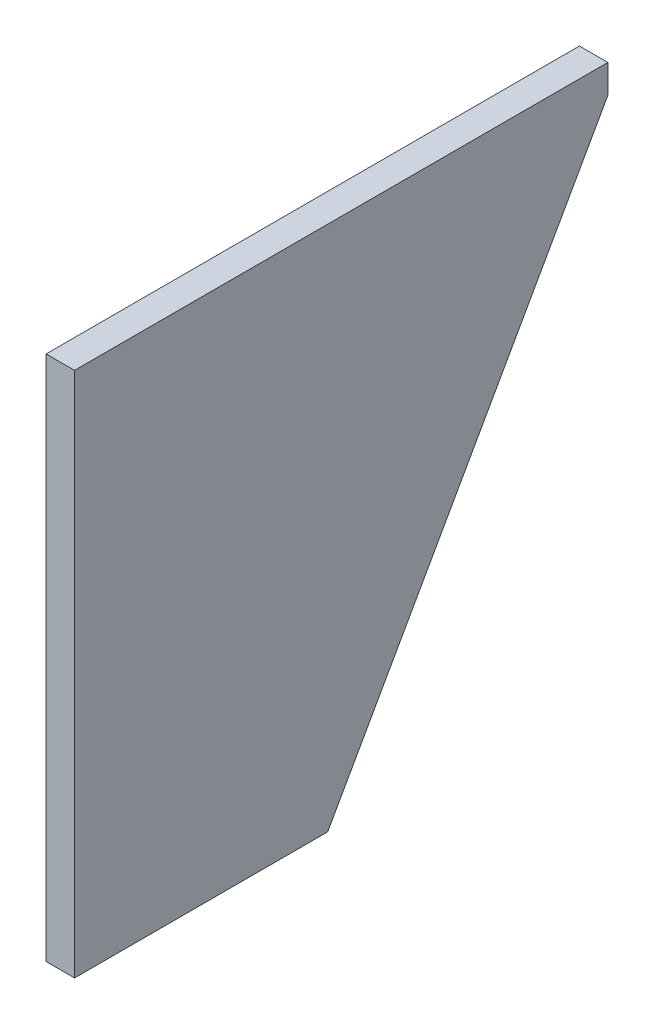
from build123d import *

# Parameters (mm, degrees)
SALIENTE_EXTRUIR1_DEPTH = 20


with BuildPart() as part:
    # Croquis2 → Saliente-Extruir1 (new body)
    with BuildSketch(Plane.ZY.offset(192.754092983)):
        Polygon((360, 202.834413862), (360, -167.165586138), (182, -167.165586138), (-15, 182.834413862), (-15, 202.834413862), align=None)
    extrude(amount=-SALIENTE_EXTRUIR1_DEPTH)


solid = part.part
